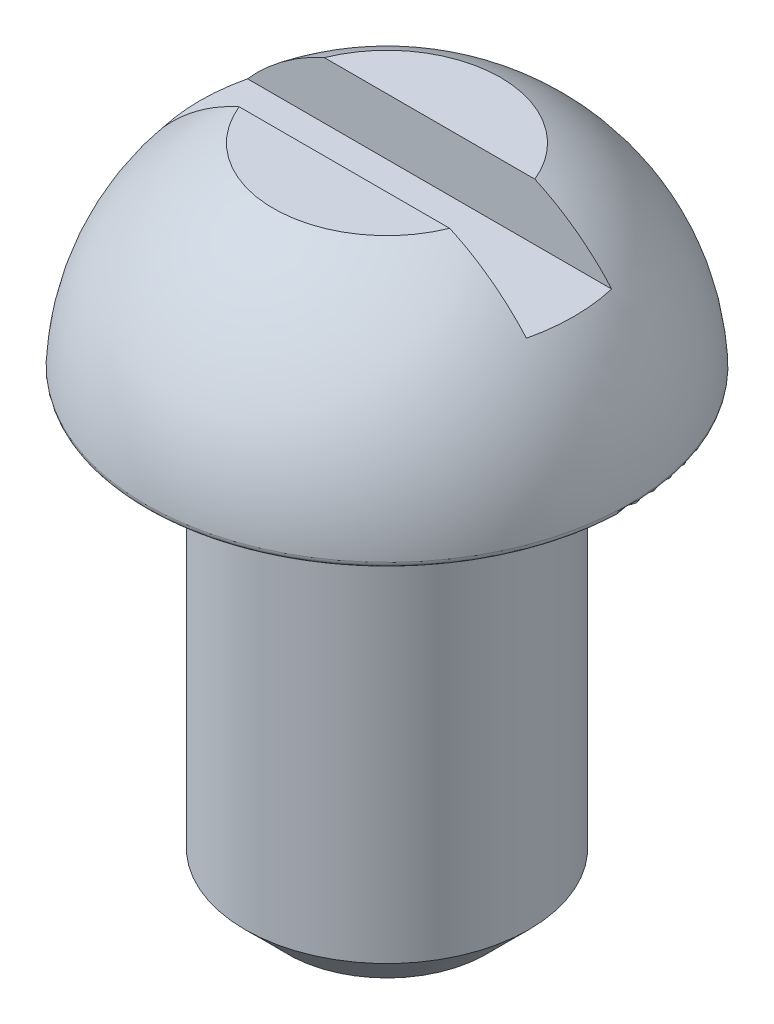
from build123d import *

# Parameters (mm, degrees)
FILLET_1_R          = 0.1
SKETCH_3_W          = 8
SKETCH_3_H          = 1.5
CUT_EXTRUDE_2_DEPTH = 1


with BuildPart() as part:
    # Эскиз1 → Повернуть1 (revolve)
    with BuildSketch(Plane.XY):
        with BuildLine():
            Line((4.25, 8), (2.5, 8))
            Line((2.5, 8), (2.5, 0.75))
            Line((2.5, 0.75), (1.75, 0))
            Line((1.75, 0), (0, 0))
            Line((0, 0), (0, 11.5))
            Line((0, 11.5), (2, 11.5))
            ThreePointArc((2, 11.5), (3.615901166, 10.065579321), (4.25, 8))
        make_face()
    revolve(axis=Axis((0, 0, 0), (0, 1, 0)))

    # Скругление1
    fillet_1_edges = [part.edges().sort_by_distance(p)[0] for p in [
        (-4.25, 8, 0),
    ]]
    fillet(fillet_1_edges, radius=FILLET_1_R)

    # Эскиз3 → Вырез-Вытянуть2 (cut)
    with BuildSketch(Plane(origin=(0, 11.5, 0), x_dir=(-1, 0, 0), z_dir=(0, 1, 0))):
        Rectangle(SKETCH_3_W, SKETCH_3_H)
    extrude(amount=-CUT_EXTRUDE_2_DEPTH, mode=Mode.SUBTRACT)


solid = part.part
